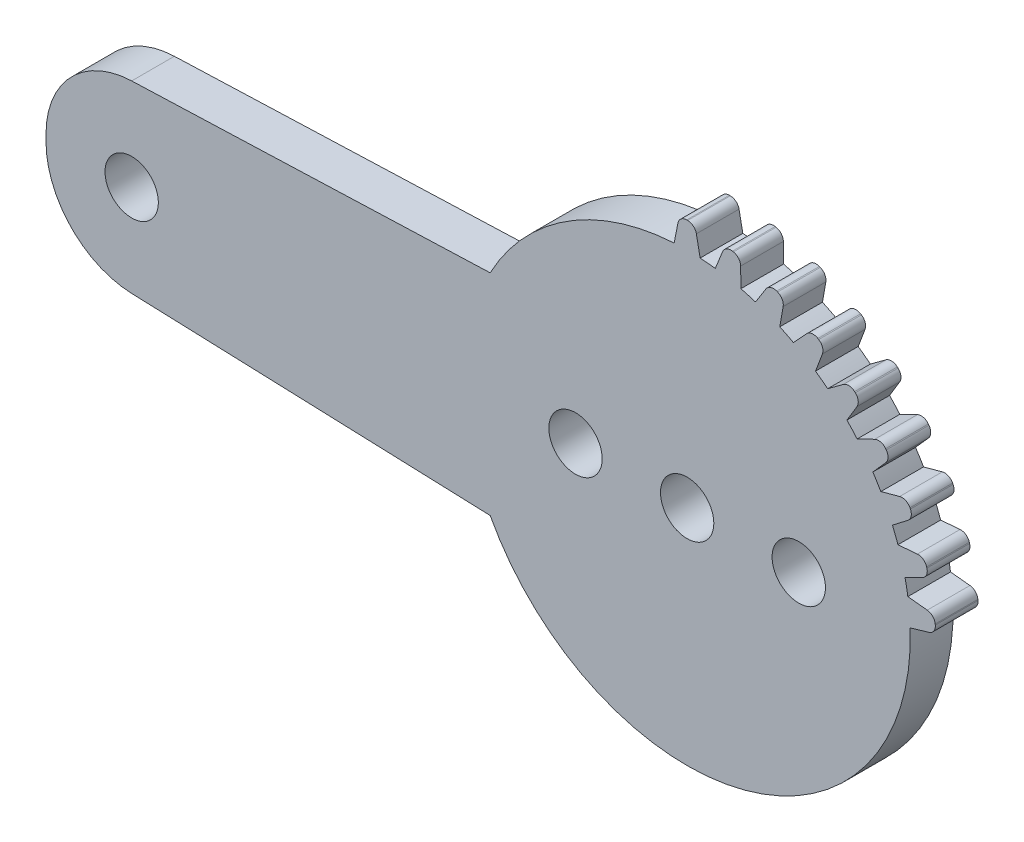
from build123d import *

# Parameters (mm, degrees)
SKETCH1_R           = 1.5
BOSS_EXTRUDE1_DEPTH = 2.4


with BuildPart() as part:
    # Sketch1 → Boss-Extrude1 (new body)
    with BuildSketch(Plane.XY):
        with BuildLine():
            Line((2.547107201, 13.777973489), (2.60207137, 13.767698905))
            ThreePointArc((2.60207137, 13.767698905), (2.893171321, 13.597662774), (3.010168721, 13.281493396))
            Line((3.010168721, 13.281493396), (3.021754222, 12.184659018))
            ThreePointArc((3.021754222, 12.184659018), (3.435499758, 12.074529199), (3.845249182, 11.950354501))
            Line((3.845249182, 11.950354501), (4.432508267, 12.876802904))
            ThreePointArc((4.432508267, 12.876802904), (4.698423191, 13.084024332), (5.035433845, 13.075347588))
            Line((5.035433845, 13.075347588), (5.087574195, 13.055148308))
            ThreePointArc((5.087574195, 13.055148308), (5.342473559, 12.83451789), (5.399382885, 12.502233681))
            Line((5.399382885, 12.502233681), (5.209228333, 11.421946163))
            ThreePointArc((5.209228333, 11.421946163), (5.595692764, 11.23766597), (5.975648384, 11.040314323))
            Line((5.975648384, 11.040314323), (6.723142715, 11.843079608))
            ThreePointArc((6.723142715, 11.843079608), (7.02260677, 11.997910958), (7.35228483, 11.927456407))
            Line((7.35228483, 11.927456407), (7.399825783, 11.898020294))
            ThreePointArc((7.399825783, 11.898020294), (7.609844268, 11.634308893), (7.604727542, 11.297225393))
            Line((7.604727542, 11.297225393), (7.219308422, 10.27027263))
            ThreePointArc((7.219308422, 10.27027263), (7.565331165, 10.018117505), (7.902554048, 9.754309483))
            Line((7.902554048, 9.754309483), (8.784828602, 10.406054439))
            ThreePointArc((8.784828602, 10.406054439), (9.107643898, 10.503223117), (9.418762572, 10.373390003))
            Line((9.418762572, 10.373390003), (9.460085179, 10.335719469))
            ThreePointArc((9.460085179, 10.335719469), (9.618070857, 10.03790746), (9.551102323, 9.707503643))
            Line((9.551102323, 9.707503643), (8.98354362, 8.76885728))
            ThreePointArc((8.98354362, 8.76885728), (9.277341286, 8.457414063), (9.560347713, 8.136133332))
            Line((9.560347713, 8.136133332), (10.547357686, 8.614663568))
            ThreePointArc((10.547357686, 8.614663568), (10.882531136, 8.650860609), (11.164495652, 8.466070244))
            Line((11.164495652, 8.466070244), (11.198192721, 8.421448114))
            ThreePointArc((11.198192721, 8.421448114), (11.298765579, 8.099677128), (11.172225769, 7.7872045))
            Line((11.172225769, 7.7872045), (10.441855016, 6.968829012))
            ThreePointArc((10.441855016, 6.968829012), (10.673422677, 6.608703529), (10.892575202, 6.240890918))
            Line((10.892575202, 6.240890918), (11.950709155, 6.529910661))
            ThreePointArc((11.950709155, 6.529910661), (12.286826829, 6.503903419), (12.530035223, 6.270448618))
            Line((12.530035223, 6.270448618), (12.55495924, 6.220394444))
            ThreePointArc((12.55495924, 6.220394444), (12.594694391, 5.885622006), (12.412892467, 5.601721447))
            Line((12.412892467, 5.601721447), (11.544581562, 4.931485631))
            ThreePointArc((11.544581562, 4.931485631), (11.70603346, 4.534941522), (11.853869106, 4.133122449))
            Line((11.853869106, 4.133122449), (12.947093557, 4.222789479))
            ThreePointArc((12.947093557, 4.222789479), (13.27270937, 4.135463598), (13.468879472, 3.861294384))
            Line((13.468879472, 3.861294384), (13.48418168, 3.807512701))
            ThreePointArc((13.48418168, 3.807512701), (13.461725991, 3.471139085), (13.230852999, 3.225478489))
            Line((13.230852999, 3.225478489), (12.254171229, 2.726206422))
            ThreePointArc((12.254171229, 2.726206422), (12.340009313, 2.306747521), (12.411493716, 1.884605453))
            Line((12.411493716, 1.884605453), (13.502580216, 1.771866265))
            ThreePointArc((13.502580216, 1.771866265), (13.806605713, 1.626195525), (13.949057185, 1.320648401))
            Line((13.949057185, 1.320648401), (13.954216486, 1.26497068))
            ThreePointArc((13.954216486, 1.26497068), (13.870334657, 0.938450687), (13.598252701, 0.73939573))
            Line((13.598252701, 0.73939573), (12.546459793, 0.428089522))
            ThreePointArc((12.546459793, 0.428089522), (3.253260702, -12.124900362), (-11.075595423, -5.91))
            Line((-11.075595423, -5.91), (-31.235799276, -5.175527107))
            ThreePointArc((-31.235799276, -5.175527107), (-34.653079748, -3.649418925), (-36.053760949, -0.178842001))
            Line((-36.053760949, -0.178842001), (-36.053760949, 0.178842001))
            ThreePointArc((-36.053760949, 0.178842001), (-34.653079748, 3.649418925), (-31.235799276, 5.175527107))
            Line((-31.235799276, 5.175527107), (-11.075595423, 5.91))
            ThreePointArc((-11.075595423, 5.91), (-6.768701925, 10.572681222), (-0.731377895, 12.532437925))
            Line((-0.731377895, 12.532437925), (-0.518446871, 13.608467783))
            ThreePointArc((-0.518446871, 13.608467783), (-0.345345603, 13.89775556), (-0.027958125, 14.011407027))
            Line((-0.027958125, 14.011407027), (0.027958125, 14.011407027))
            ThreePointArc((0.027958125, 14.011407027), (0.345345603, 13.89775556), (0.518446871, 13.608467783))
            Line((0.518446871, 13.608467783), (0.731377895, 12.532437925))
            ThreePointArc((0.731377895, 12.532437925), (1.158314928, 12.500208818), (1.58390463, 12.453439689))
            Line((1.58390463, 12.453439689), (1.990930066, 13.472022121))
            ThreePointArc((1.990930066, 13.472022121), (2.214240445, 13.72457695), (2.547107201, 13.777973489))
        make_face()
        with Locations((6.276880475, 0)):
            Circle(SKETCH1_R, mode=Mode.SUBTRACT)
        with Locations((-6.276880475, 0)):
            Circle(SKETCH1_R, mode=Mode.SUBTRACT)
        Circle(SKETCH1_R, mode=Mode.SUBTRACT)
        with Locations((-31.235799276, 0)):
            Circle(SKETCH1_R, mode=Mode.SUBTRACT)
    extrude(amount=BOSS_EXTRUDE1_DEPTH)


solid = part.part
